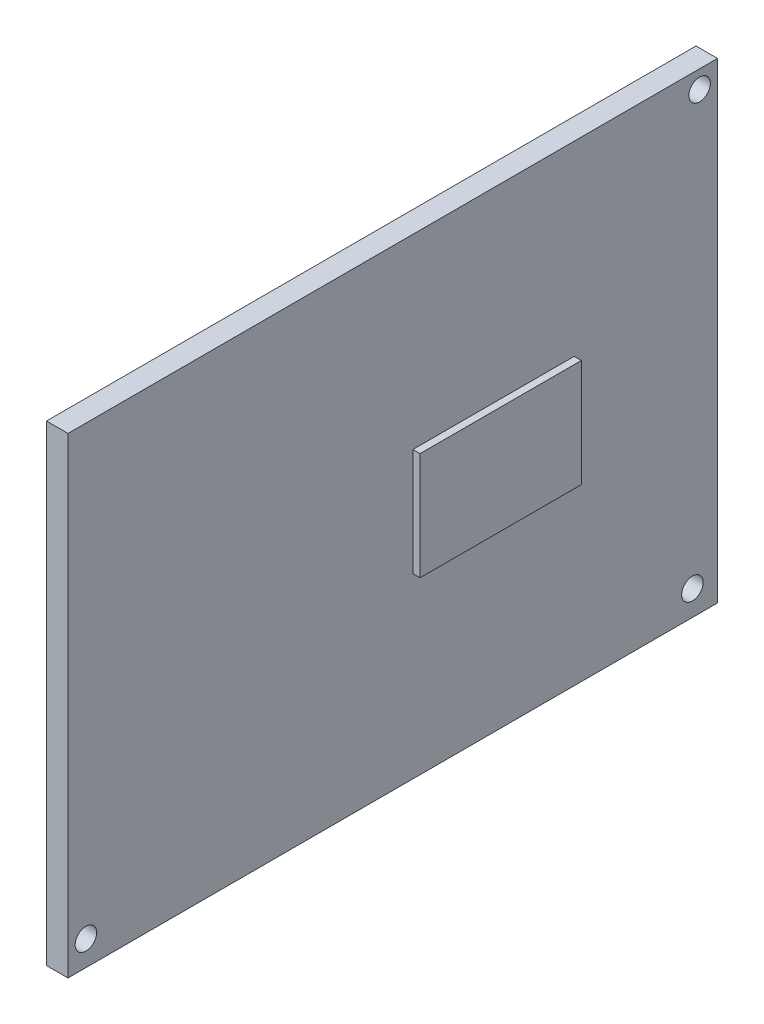
from build123d import *

# Parameters (mm, degrees)
CROQUIS1_W              = 90.62
CROQUIS1_H              = 65.8
CROQUIS1_R              = 1.5
SALIENTE_EXTRUIR1_DEPTH = 3
CROQUIS2_W              = 22.5
CROQUIS2_H              = 15
SALIENTE_EXTRUIR2_DEPTH = 1


with BuildPart() as part:
    # Croquis1 → Saliente-Extruir1 (new body)
    with BuildSketch(Plane(origin=(0, 0, 0), x_dir=(0, 0, -1), z_dir=(1, 0, 0))):
        with Locations((45.31, 32.9)):
            Rectangle(CROQUIS1_W, CROQUIS1_H)
        with Locations((88.12, 63.3)):
            Circle(CROQUIS1_R, mode=Mode.SUBTRACT)
        with Locations((87.12, 3.5)):
            Circle(CROQUIS1_R, mode=Mode.SUBTRACT)
        with Locations((2.5, 3.5)):
            Circle(CROQUIS1_R, mode=Mode.SUBTRACT)
    extrude(amount=SALIENTE_EXTRUIR1_DEPTH)

    # Croquis2 → Saliente-Extruir2 (add)
    with BuildSketch(Plane(origin=(3, 0, 0), x_dir=(0, 0, -1), z_dir=(1, 0, 0))):
        with Locations((59.37, 32.3)):
            Rectangle(CROQUIS2_W, CROQUIS2_H)
    extrude(amount=SALIENTE_EXTRUIR2_DEPTH)


solid = part.part
